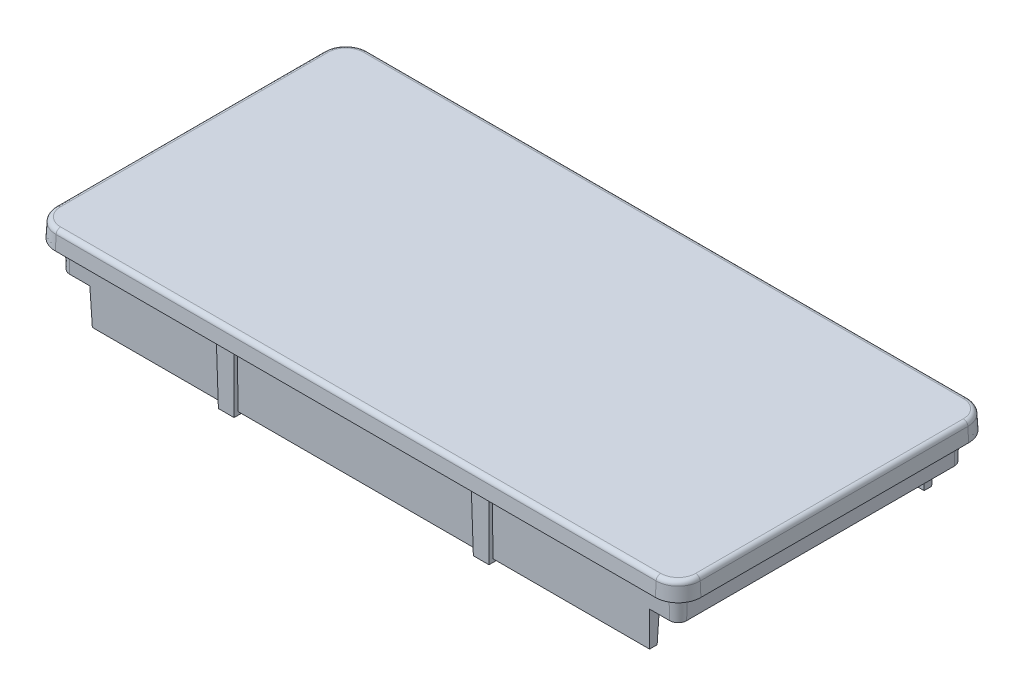
from build123d import *

# Parameters (mm, degrees)
BOSS_EXTRUDE1_DEPTH           = 2
BOSS_EXTRUDE1_TAPER           = 3
FILLET1_R                     = 0.5
CUT_EXTRUDE1_DEPTH            = 0.5
BOSS_EXTRUDE2_DEPTH           = 7.45
BOSS_EXTRUDE2_DRAFT           = 2
CUT_EXTRUDE2_DEPTH            = 0.2
CUT_EXTRUDE2_DRAFT            = -2
SKETCH7_W                     = 80
SKETCH7_H                     = 26.5
CUT_EXTRUDE3_DEPTH            = 3.95
SKETCH6_W                     = 5.817002818
SKETCH6_H                     = 5.817002818
CUT_EXTRUDE4_DEPTH            = 3.95
CUT_EXTRUDE4_DRAFT            = -2
CUT_EXTRUDE4_PROFILE_2_DEPTH  = 3.95
CUT_EXTRUDE4_PROFILE_2_DRAFT  = -2
CUT_EXTRUDE4_PROFILE_3_DEPTH  = 3.95
CUT_EXTRUDE4_PROFILE_3_DRAFT  = -2
CUT_EXTRUDE4_PROFILE_4_DEPTH  = 3.95
CUT_EXTRUDE4_PROFILE_4_DRAFT  = -2
FILLET3_R                     = 0.5
SKETCH16_W                    = 2
SKETCH16_H                    = 2
BOSS_EXTRUDE7_DEPTH           = 8
BOSS_EXTRUDE7_DRAFT           = 1
BOSS_EXTRUDE7_PROFILE_2_DEPTH = 8
BOSS_EXTRUDE7_PROFILE_2_DRAFT = 1
BOSS_EXTRUDE7_PROFILE_3_DEPTH = 8
BOSS_EXTRUDE7_PROFILE_3_DRAFT = 1
BOSS_EXTRUDE7_PROFILE_4_DEPTH = 8
BOSS_EXTRUDE7_PROFILE_4_DRAFT = 1


with BuildPart() as part:
    # Sketch1 → Boss-Extrude1 (new body)
    with BuildSketch(Plane(origin=(0, 0, 0), x_dir=(1, 0, 0), z_dir=(0, 1, 0))):
        with BuildLine():
            Line((-32.95, -17.2), (32.95, -17.2))
            ThreePointArc((32.95, -17.2), (34.717766953, -16.467766953), (35.45, -14.7))
            Line((35.45, -14.7), (35.45, 14.7))
            ThreePointArc((35.45, 14.7), (34.717766953, 16.467766953), (32.95, 17.2))
            Line((32.95, 17.2), (-32.95, 17.2))
            ThreePointArc((-32.95, 17.2), (-34.717766953, 16.467766953), (-35.45, 14.7))
            Line((-35.45, 14.7), (-35.45, -14.7))
            ThreePointArc((-35.45, -14.7), (-34.717766953, -16.467766953), (-32.95, -17.2))
        make_face()
    extrude(amount=BOSS_EXTRUDE1_DEPTH, taper=BOSS_EXTRUDE1_TAPER)

    # Fillet1
    fillet1_edges = [part.edges().sort_by_distance(p)[0] for p in [
        (34.643651161, 2, -16.393651161),
        (0, 2, -17.095184441),
        (-34.643651161, 2, -16.393651161),
        (-35.345184441, 2, 0),
        (-34.643651161, 2, 16.393651161),
        (0, 2, 17.095184441),
        (34.643651161, 2, 16.393651161),
        (35.345184441, 2, 0),
    ]]
    fillet(fillet1_edges, radius=FILLET1_R)

    # Sketch2 → Cut-Extrude1 (cut)
    with BuildSketch(Plane.XZ):
        with BuildLine():
            Line((32.95, 16.45), (-32.95, 16.45))
            ThreePointArc((-32.95, 16.45), (-34.187436867, 15.937436867), (-34.7, 14.7))
            Line((-34.7, 14.7), (-34.7, -14.7))
            ThreePointArc((-34.7, -14.7), (-34.187436867, -15.937436867), (-32.95, -16.45))
            Line((-32.95, -16.45), (32.95, -16.45))
            ThreePointArc((32.95, -16.45), (34.187436867, -15.937436867), (34.7, -14.7))
            Line((34.7, -14.7), (34.7, 14.7))
            ThreePointArc((34.7, 14.7), (34.187436867, 15.937436867), (32.95, 16.45))
        make_face()
    extrude(amount=-CUT_EXTRUDE1_DEPTH, mode=Mode.SUBTRACT)


with BuildPart() as boss_extrude2_tool:
    # Sketch4 → Boss-Extrude2 (with draft: the straight prism first)
    with BuildSketch(Plane.XZ.offset(-0.5)):
        with BuildLine():
            Line((32.95, 15.75), (-32.95, 15.75))
            ThreePointArc((-32.95, 15.75), (-33.69246212, 15.44246212), (-34, 14.7))
            Line((-34, 14.7), (-34, -14.7))
            ThreePointArc((-34, -14.7), (-33.69246212, -15.44246212), (-32.95, -15.75))
            Line((-32.95, -15.75), (32.95, -15.75))
            ThreePointArc((32.95, -15.75), (33.69246212, -15.44246212), (34, -14.7))
            Line((34, -14.7), (34, 14.7))
            ThreePointArc((34, 14.7), (33.69246212, 15.44246212), (32.95, 15.75))
        make_face()
        with BuildLine():
            Line((31.65, -14.4), (-31.65, -14.4))
            ThreePointArc((-31.65, -14.4), (-32.357106781, -14.107106781), (-32.65, -13.4))
            Line((-32.65, -13.4), (-32.65, 13.4))
            ThreePointArc((-32.65, 13.4), (-32.357106781, 14.107106781), (-31.65, 14.4))
            Line((-31.65, 14.4), (31.65, 14.4))
            ThreePointArc((31.65, 14.4), (32.357106781, 14.107106781), (32.65, 13.4))
            Line((32.65, 13.4), (32.65, -13.4))
            ThreePointArc((32.65, -13.4), (32.357106781, -14.107106781), (31.65, -14.4))
        make_face(mode=Mode.SUBTRACT)
    extrude(amount=BOSS_EXTRUDE2_DEPTH)
    # Boss-Extrude2: the draft: its side faces are tilted about the plane it starts from
    boss_extrude2_sides = [boss_extrude2_tool.faces().sort_by_distance(p)[0] for p in [
        (0, -3.225, 15.75),
        (-33.69246212, -3.225, 15.44246212),
        (-34, -3.225, 0),
        (-33.69246212, -3.225, -15.44246212),
        (0, -3.225, -15.75),
        (33.69246212, -3.225, -15.44246212),
        (34, -3.225, 0),
        (33.69246212, -3.225, 15.44246212),
        (0, -3.225, -14.4),
        (-32.357106781, -3.225, -14.107106781),
        (-32.65, -3.225, 0),
        (-32.357106781, -3.225, 14.107106781),
        (0, -3.225, 14.4),
        (32.357106781, -3.225, 14.107106781),
        (32.65, -3.225, 0),
        (32.357106781, -3.225, -14.107106781),
    ]]
    draft(boss_extrude2_sides, Plane.XZ.offset(-0.5), BOSS_EXTRUDE2_DRAFT)


with BuildPart() as part_1:
    add(part.part)

    # Boss-Extrude2: add boss_extrude2_tool
    add(boss_extrude2_tool.part)


with BuildPart() as cut_extrude2_tool:
    # Sketch5 → Cut-Extrude2 (with draft: the straight prism first)
    with BuildSketch(Plane.XZ.offset(-0.5)):
        with BuildLine():
            Line((31.65, 14.4), (-31.65, 14.4))
            ThreePointArc((-31.65, 14.4), (-32.357106781, 14.107106781), (-32.65, 13.4))
            Line((-32.65, 13.4), (-32.65, -13.4))
            ThreePointArc((-32.65, -13.4), (-32.357106781, -14.107106781), (-31.65, -14.4))
            Line((-31.65, -14.4), (31.65, -14.4))
            ThreePointArc((31.65, -14.4), (32.357106781, -14.107106781), (32.65, -13.4))
            Line((32.65, -13.4), (32.65, 13.4))
            ThreePointArc((32.65, 13.4), (32.357106781, 14.107106781), (31.65, 14.4))
        make_face()
    extrude(amount=-CUT_EXTRUDE2_DEPTH)
    # Cut-Extrude2: the draft: its side faces are tilted about the plane it starts from
    cut_extrude2_sides = [cut_extrude2_tool.faces().sort_by_distance(p)[0] for p in [
        (0, 0.6, 14.4),
        (-32.357106781, 0.6, 14.107106781),
        (-32.65, 0.6, 0),
        (-32.357106781, 0.6, -14.107106781),
        (0, 0.6, -14.4),
        (32.357106781, 0.6, -14.107106781),
        (32.65, 0.6, 0),
        (32.357106781, 0.6, 14.107106781),
    ]]
    draft(cut_extrude2_sides, Plane.XZ.offset(-0.5), CUT_EXTRUDE2_DRAFT)


with BuildPart() as part_2:
    add(part_1.part)

    # Cut-Extrude2: cut by cut_extrude2_tool
    add(cut_extrude2_tool.part, mode=Mode.SUBTRACT)

    # Sketch7 → Cut-Extrude3 (cut)
    with BuildSketch(Plane.XZ.offset(6.95)):
        Rectangle(SKETCH7_W, SKETCH7_H)
    extrude(amount=-CUT_EXTRUDE3_DEPTH, mode=Mode.SUBTRACT)


with BuildPart() as cut_extrude4_tool:
    # Sketch6 → Cut-Extrude4 (with draft: the straight prism first)
    with BuildSketch(Plane.XZ.offset(6.95)):
        with Locations((-33.508501409, 15.258501409)):
            Rectangle(SKETCH6_W, SKETCH6_H)
    extrude(amount=-CUT_EXTRUDE4_DEPTH)
    # Cut-Extrude4: the draft: its side faces are tilted about the plane it starts from
    cut_extrude4_sides = [cut_extrude4_tool.faces().sort_by_distance(p)[0] for p in [
        (-36.417002818, -4.975, 15.258501409),
        (-33.508501409, -4.975, 12.35),
        (-30.6, -4.975, 15.258501409),
        (-33.508501409, -4.975, 18.167002818),
    ]]
    draft(cut_extrude4_sides, Plane.XZ.offset(6.95), CUT_EXTRUDE4_DRAFT)


with BuildPart() as part_3:
    add(part_2.part)

    # Cut-Extrude4: cut by cut_extrude4_tool
    add(cut_extrude4_tool.part, mode=Mode.SUBTRACT)


with BuildPart() as cut_extrude4_profile_2_tool:
    # Sketch6 → Cut-Extrude4 profile 2 (with draft: the straight prism first)
    with BuildSketch(Plane.XZ.offset(6.95)):
        with Locations((33.508501409, 15.258501409)):
            Rectangle(SKETCH6_W, SKETCH6_H)
    extrude(amount=-CUT_EXTRUDE4_PROFILE_2_DEPTH)
    # Cut-Extrude4 profile 2: the draft: its side faces are tilted about the plane it starts from
    cut_extrude4_profile_2_sides = [cut_extrude4_profile_2_tool.faces().sort_by_distance(p)[0] for p in [
        (30.6, -4.975, 15.258501409),
        (33.508501409, -4.975, 12.35),
        (36.417002818, -4.975, 15.258501409),
        (33.508501409, -4.975, 18.167002818),
    ]]
    draft(cut_extrude4_profile_2_sides, Plane.XZ.offset(6.95), CUT_EXTRUDE4_PROFILE_2_DRAFT)


with BuildPart() as part_4:
    add(part_3.part)

    # Cut-Extrude4 profile 2: cut by cut_extrude4_profile_2_tool
    add(cut_extrude4_profile_2_tool.part, mode=Mode.SUBTRACT)


with BuildPart() as cut_extrude4_profile_3_tool:
    # Sketch6 → Cut-Extrude4 profile 3 (with draft: the straight prism first)
    with BuildSketch(Plane.XZ.offset(6.95)):
        with Locations((33.508501409, -15.258501409)):
            Rectangle(SKETCH6_W, SKETCH6_H)
    extrude(amount=-CUT_EXTRUDE4_PROFILE_3_DEPTH)
    # Cut-Extrude4 profile 3: the draft: its side faces are tilted about the plane it starts from
    cut_extrude4_profile_3_sides = [cut_extrude4_profile_3_tool.faces().sort_by_distance(p)[0] for p in [
        (36.417002818, -4.975, -15.258501409),
        (33.508501409, -4.975, -12.35),
        (30.6, -4.975, -15.258501409),
        (33.508501409, -4.975, -18.167002818),
    ]]
    draft(cut_extrude4_profile_3_sides, Plane.XZ.offset(6.95), CUT_EXTRUDE4_PROFILE_3_DRAFT)


with BuildPart() as part_5:
    add(part_4.part)

    # Cut-Extrude4 profile 3: cut by cut_extrude4_profile_3_tool
    add(cut_extrude4_profile_3_tool.part, mode=Mode.SUBTRACT)


with BuildPart() as cut_extrude4_profile_4_tool:
    # Sketch6 → Cut-Extrude4 profile 4 (with draft: the straight prism first)
    with BuildSketch(Plane.XZ.offset(6.95)):
        with Locations((-33.508501409, -15.258501409)):
            Rectangle(SKETCH6_W, SKETCH6_H)
    extrude(amount=-CUT_EXTRUDE4_PROFILE_4_DEPTH)
    # Cut-Extrude4 profile 4: the draft: its side faces are tilted about the plane it starts from
    cut_extrude4_profile_4_sides = [cut_extrude4_profile_4_tool.faces().sort_by_distance(p)[0] for p in [
        (-30.6, -4.975, -15.258501409),
        (-33.508501409, -4.975, -12.35),
        (-36.417002818, -4.975, -15.258501409),
        (-33.508501409, -4.975, -18.167002818),
    ]]
    draft(cut_extrude4_profile_4_sides, Plane.XZ.offset(6.95), CUT_EXTRUDE4_PROFILE_4_DRAFT)


with BuildPart() as part_6:
    add(part_5.part)

    # Cut-Extrude4 profile 4: cut by cut_extrude4_profile_4_tool
    add(cut_extrude4_profile_4_tool.part, mode=Mode.SUBTRACT)

    # Fillet3
    fillet3_edges = [part_6.edges().sort_by_distance(p)[0] for p in [
        (32.352168239, 0.7, 14.102168239),
        (32.643015846, 0.7, 0),
        (32.352168239, 0.7, -14.102168239),
        (0, 0.7, -14.393015846),
        (-32.352168239, 0.7, -14.102168239),
        (-32.643015846, 0.7, 0),
        (-32.352168239, 0.7, 14.102168239),
        (0, 0.7, 14.393015846),
    ]]
    fillet(fillet3_edges, radius=FILLET3_R)


with BuildPart() as boss_extrude7_tool:
    # Sketch16 → Boss-Extrude7 (with draft: the straight prism first)
    with BuildSketch(Plane.XZ.offset(-0.7)):
        with Locations((-15.45, 15.075)):
            Rectangle(SKETCH16_W, SKETCH16_H)
    extrude(amount=BOSS_EXTRUDE7_DEPTH)
    # Boss-Extrude7: the draft: its side faces are tilted about the plane it starts from
    boss_extrude7_sides = [boss_extrude7_tool.faces().sort_by_distance(p)[0] for p in [
        (-15.45, -3.3, 14.075),
        (-14.45, -3.3, 15.075),
        (-15.45, -3.3, 16.075),
        (-16.45, -3.3, 15.075),
    ]]
    draft(boss_extrude7_sides, Plane.XZ.offset(-0.7), BOSS_EXTRUDE7_DRAFT)


with BuildPart() as part_7:
    add(part_6.part)

    # Boss-Extrude7: add boss_extrude7_tool
    add(boss_extrude7_tool.part)


with BuildPart() as boss_extrude7_profile_2_tool:
    # Sketch16 → Boss-Extrude7 profile 2 (with draft: the straight prism first)
    with BuildSketch(Plane.XZ.offset(-0.7)):
        with Locations((12.55, 15.075)):
            Rectangle(SKETCH16_W, SKETCH16_H)
    extrude(amount=BOSS_EXTRUDE7_PROFILE_2_DEPTH)
    # Boss-Extrude7 profile 2: the draft: its side faces are tilted about the plane it starts from
    boss_extrude7_profile_2_sides = [boss_extrude7_profile_2_tool.faces().sort_by_distance(p)[0] for p in [
        (12.55, -3.3, 14.075),
        (13.55, -3.3, 15.075),
        (12.55, -3.3, 16.075),
        (11.55, -3.3, 15.075),
    ]]
    draft(boss_extrude7_profile_2_sides, Plane.XZ.offset(-0.7), BOSS_EXTRUDE7_PROFILE_2_DRAFT)


with BuildPart() as part_8:
    add(part_7.part)

    # Boss-Extrude7 profile 2: add boss_extrude7_profile_2_tool
    add(boss_extrude7_profile_2_tool.part)


with BuildPart() as boss_extrude7_profile_3_tool:
    # Sketch16 → Boss-Extrude7 profile 3 (with draft: the straight prism first)
    with BuildSketch(Plane.XZ.offset(-0.7)):
        with Locations((12.55, -15.075)):
            Rectangle(SKETCH16_W, SKETCH16_H)
    extrude(amount=BOSS_EXTRUDE7_PROFILE_3_DEPTH)
    # Boss-Extrude7 profile 3: the draft: its side faces are tilted about the plane it starts from
    boss_extrude7_profile_3_sides = [boss_extrude7_profile_3_tool.faces().sort_by_distance(p)[0] for p in [
        (12.55, -3.3, -14.075),
        (11.55, -3.3, -15.075),
        (12.55, -3.3, -16.075),
        (13.55, -3.3, -15.075),
    ]]
    draft(boss_extrude7_profile_3_sides, Plane.XZ.offset(-0.7), BOSS_EXTRUDE7_PROFILE_3_DRAFT)


with BuildPart() as part_9:
    add(part_8.part)

    # Boss-Extrude7 profile 3: add boss_extrude7_profile_3_tool
    add(boss_extrude7_profile_3_tool.part)


with BuildPart() as boss_extrude7_profile_4_tool:
    # Sketch16 → Boss-Extrude7 profile 4 (with draft: the straight prism first)
    with BuildSketch(Plane.XZ.offset(-0.7)):
        with Locations((-15.45, -15.075)):
            Rectangle(SKETCH16_W, SKETCH16_H)
    extrude(amount=BOSS_EXTRUDE7_PROFILE_4_DEPTH)
    # Boss-Extrude7 profile 4: the draft: its side faces are tilted about the plane it starts from
    boss_extrude7_profile_4_sides = [boss_extrude7_profile_4_tool.faces().sort_by_distance(p)[0] for p in [
        (-15.45, -3.3, -14.075),
        (-16.45, -3.3, -15.075),
        (-15.45, -3.3, -16.075),
        (-14.45, -3.3, -15.075),
    ]]
    draft(boss_extrude7_profile_4_sides, Plane.XZ.offset(-0.7), BOSS_EXTRUDE7_PROFILE_4_DRAFT)


with BuildPart() as part_10:
    add(part_9.part)

    # Boss-Extrude7 profile 4: add boss_extrude7_profile_4_tool
    add(boss_extrude7_profile_4_tool.part)


solid = part_10.part
